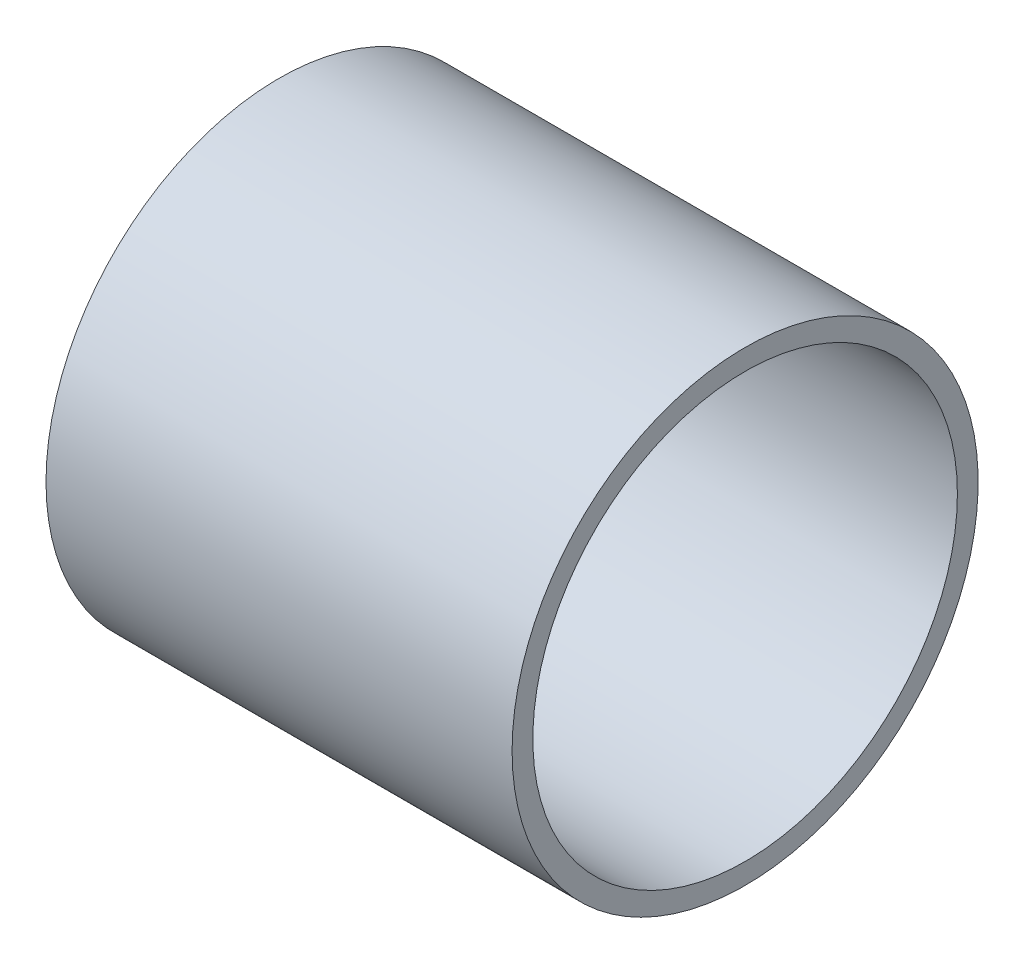
from build123d import *

# Parameters (mm, degrees)
SKETCH1_W          = 11
SKETCH1_H          = 5.5
SKETCH3_R          = 5.01
CUT_EXTRUDE1_DEPTH = 15.80920322


with BuildPart() as part:
    # Sketch1 → Revolve1 (revolve)
    with BuildSketch(Plane.XY, mode=Mode.PRIVATE) as revolve1_sk:
        Rectangle(SKETCH1_W, SKETCH1_H)
    revolve(revolve1_sk.sketch.rotate(Axis((-5.5, -2.75, 0), (1, 0, 0)), 90), axis=Axis((-5.5, -2.75, 0), (1, 0, 0)))

    # Sketch3 → Cut-Extrude1 (cut, through all)
    with BuildSketch(Plane(origin=(5.5, 0, 0), x_dir=(0, 0, -1), z_dir=(1, 0, 0))):
        with Locations((0, -2.75)):
            Circle(SKETCH3_R)
    extrude(amount=-CUT_EXTRUDE1_DEPTH, mode=Mode.SUBTRACT)


solid = part.part
